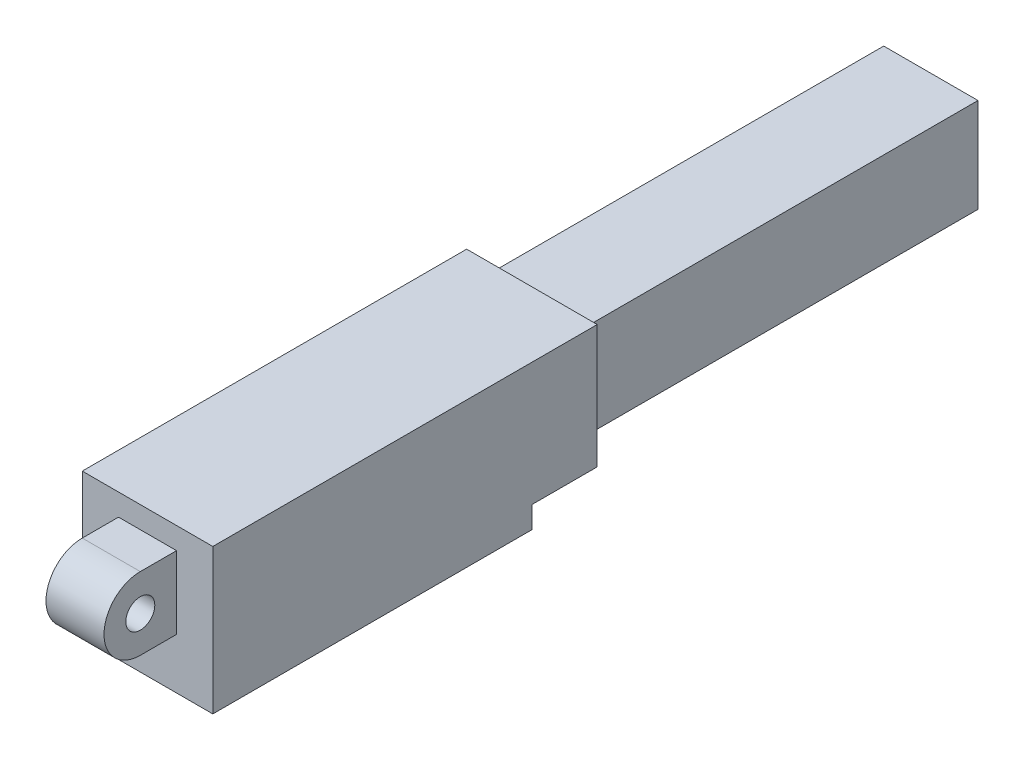
from build123d import *

# Parameters (mm, degrees)
BOSS_EXTRUDE1_DEPTH = 9
SKETCH2_R           = 2
BOSS_EXTRUDE2_DEPTH = 4
SKETCH3_W           = 13
SKETCH3_H           = 13
BOSS_EXTRUDE3_DEPTH = 55


with BuildPart() as part:
    # Sketch1 → Boss-Extrude1 (new, symmetric)
    with BuildSketch(Plane(origin=(0, 0, 0), x_dir=(0, 0, -1), z_dir=(1, 0, 0))):
        Polygon((-26.5, 10), (26.5, 10), (26.5, -7), (17.5, -7), (17.5, -10), (-26.5, -10), align=None)
    extrude(amount=BOSS_EXTRUDE1_DEPTH, both=True)

    # Sketch2 → Boss-Extrude2 (add, symmetric)
    with BuildSketch(Plane(origin=(0, 0, 0), x_dir=(0, 0, -1), z_dir=(1, 0, 0))):
        with BuildLine():
            Line((-31.5, 7), (-26.5, 7))
            Line((-26.5, 7), (-26.5, -3))
            Line((-26.5, -3), (-31.5, -3))
            ThreePointArc((-31.5, -3), (-36.5, 2), (-31.5, 7))
        make_face()
        with Locations((-31.5, 2)):
            Circle(SKETCH2_R, mode=Mode.SUBTRACT)
    extrude(amount=BOSS_EXTRUDE2_DEPTH, both=True)

    # Sketch3 → Boss-Extrude3 (add)
    with BuildSketch(Plane(origin=(0, 0, -26.5), x_dir=(-1, 0, 0), z_dir=(0, 0, -1))):
        with Locations((0, 1.5)):
            Rectangle(SKETCH3_W, SKETCH3_H)
    extrude(amount=BOSS_EXTRUDE3_DEPTH)


solid = part.part
